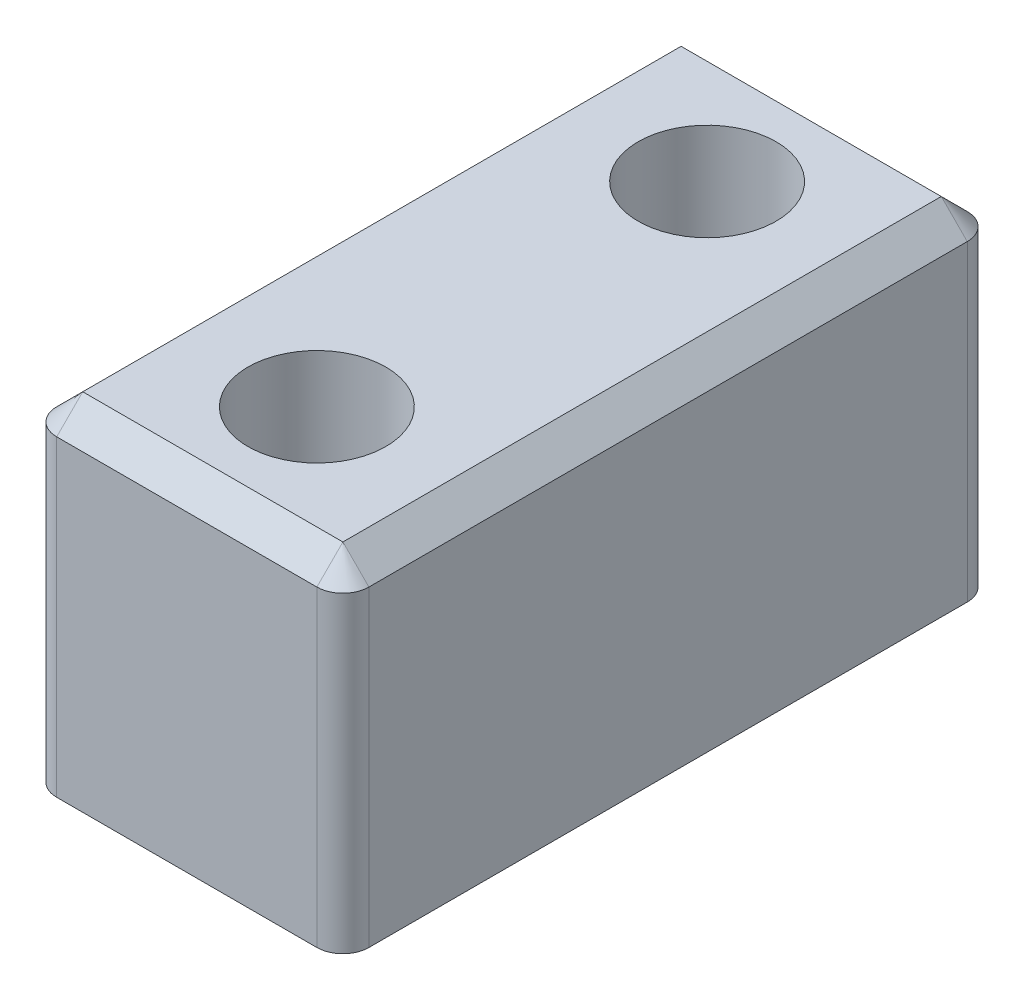
from build123d import *

# Parameters (mm, degrees)
SKETCH1_W           = 12
SKETCH1_H           = 25
SKETCH1_R           = 2.65
BOSS_EXTRUDE1_DEPTH = 6.5
FILLET1_R           = 1
CHAMFER1_SIZE       = 1


with BuildPart() as part:
    # Sketch1 → Boss-Extrude1 (new, symmetric)
    with BuildSketch(Plane(origin=(0, 0, 0), x_dir=(1, 0, 0), z_dir=(0, 1, 0))):
        Rectangle(SKETCH1_W, SKETCH1_H)
        with Locations(Location((0, 7.5, 0), (0, 0, 90))):
            Circle(SKETCH1_R, mode=Mode.SUBTRACT)
        with Locations(Location((0, -7.5, 0), (0, 0, 90))):
            Circle(SKETCH1_R, mode=Mode.SUBTRACT)
    extrude(amount=BOSS_EXTRUDE1_DEPTH, both=True)

    # Fillet1
    fillet1_edges = [part.edges().sort_by_distance(p)[0] for p in [
        (6, 0, 12.5),
        (-6, 0, 12.5),
        (-6, 0, -12.5),
        (6, 0, -12.5),
    ]]
    fillet(fillet1_edges, radius=FILLET1_R)

    # Chamfer1
    chamfer1_edges = [part.edges().sort_by_distance(p)[0] for p in [
        (0, 6.5, 12.5),
        (-6, 6.5, 0),
        (6, 6.5, 0),
        (0, 6.5, -12.5),
        (5.707106781, 6.5, 12.207106781),
        (5.707106781, 6.5, -12.207106781),
        (-5.707106781, 6.5, -12.207106781),
        (-5.707106781, 6.5, 12.207106781),
    ]]
    chamfer(chamfer1_edges, length=CHAMFER1_SIZE)


solid = part.part
